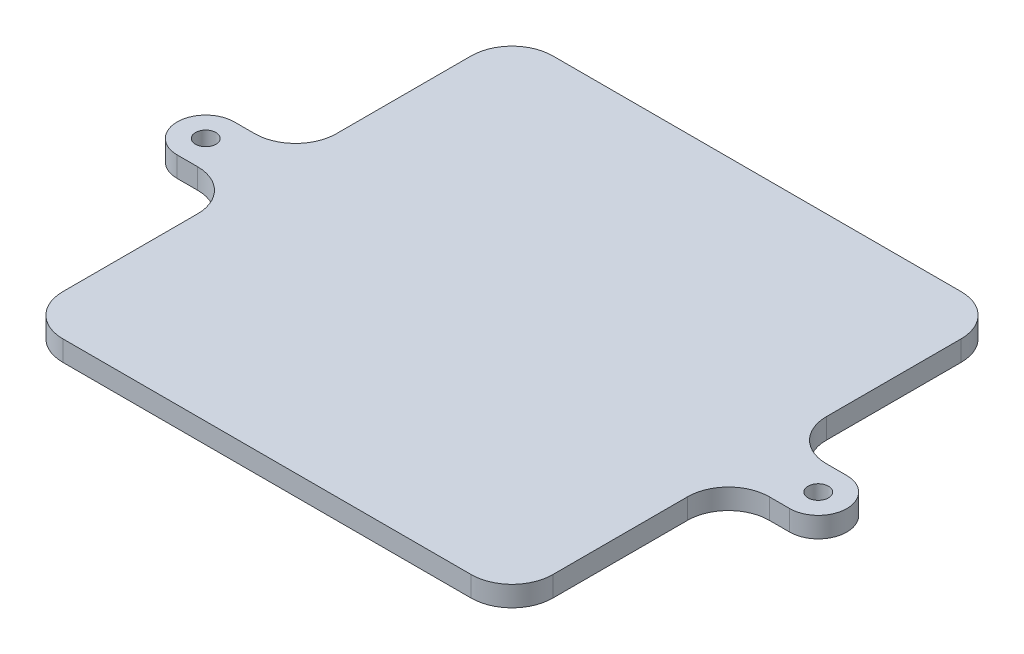
from build123d import *

# Parameters (mm, degrees)
SKETCH1_R           = 2.5
BOSS_EXTRUDE2_DEPTH = 5


with BuildPart() as part:
    # Sketch1 → Boss-Extrude2 (new body)
    with BuildSketch(Plane(origin=(0, 0, 0), x_dir=(1, 0, 0), z_dir=(0, 1, 0))):
        with BuildLine():
            Line((70, -7), (75, -7))
            ThreePointArc((75, -7), (82, 0), (75, 7))
            Line((75, 7), (70, 7))
            ThreePointArc((70, 7), (62.928932188, 9.928932188), (60, 17))
            Line((60, 17), (60, 50))
            ThreePointArc((60, 50), (57.071067812, 57.071067812), (50, 60))
            Line((50, 60), (-50, 60))
            ThreePointArc((-50, 60), (-57.071067812, 57.071067812), (-60, 50))
            Line((-60, 50), (-60, 17))
            ThreePointArc((-60, 17), (-62.928932188, 9.928932188), (-70, 7))
            Line((-70, 7), (-75, 7))
            ThreePointArc((-75, 7), (-82, 0), (-75, -7))
            Line((-75, -7), (-70, -7))
            ThreePointArc((-70, -7), (-62.928932188, -9.928932188), (-60, -17))
            Line((-60, -17), (-60, -50))
            ThreePointArc((-60, -50), (-57.071067812, -57.071067812), (-50, -60))
            Line((-50, -60), (50, -60))
            ThreePointArc((50, -60), (57.071067812, -57.071067812), (60, -50))
            Line((60, -50), (60, -17))
            ThreePointArc((60, -17), (62.928932188, -9.928932188), (70, -7))
        make_face()
        with Locations(Location((-75, 0, 0), (0, 0, 270))):
            Circle(SKETCH1_R, mode=Mode.SUBTRACT)
        with Locations(Location((75, 0, 0), (0, 0, 90))):
            Circle(SKETCH1_R, mode=Mode.SUBTRACT)
    extrude(amount=BOSS_EXTRUDE2_DEPTH)


solid = part.part
